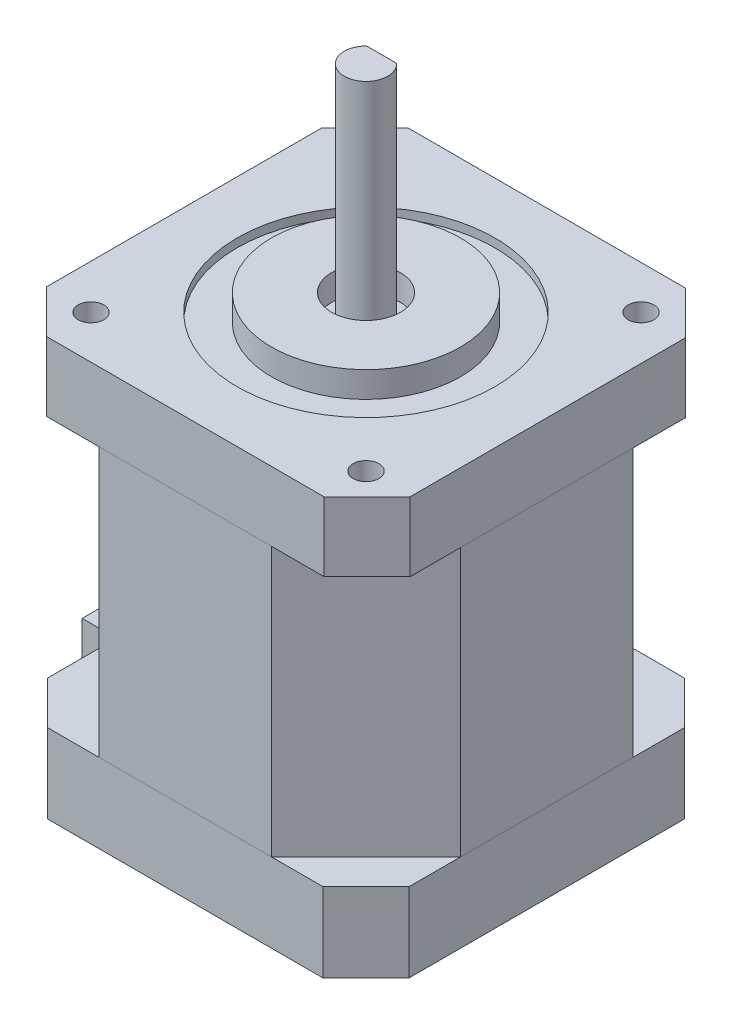
from build123d import *

# Parameters (mm, degrees)
SKETCH2_W             = 42.05
SKETCH2_H             = 42.05
BOSS_EXTRUDE1_DEPTH   = 9.2
CHAMFER1_SIZE         = 5
BOSS_EXTRUDE2_DEPTH   = 31.3
SKETCH4_W             = 42.305589702
SKETCH4_H             = 42.05
BOSS_EXTRUDE3_DEPTH   = 8.05
CHAMFER2_SIZE         = 5
SKETCH5_R             = 15
CUT_EXTRUDE1_DEPTH    = 1
SKETCH6_R             = 11
BOSS_EXTRUDE5_DEPTH   = 3
SKETCH7_R             = 4
CUT_EXTRUDE2_DEPTH    = 3
SKETCH8_R             = 2.525
BOSS_EXTRUDE6_DEPTH   = 26.05
SKETCH9_R             = 3
CUT_EXTRUDE3_DEPTH    = 24.05
SKETCH10_W            = 2
SKETCH10_H            = 16
BOSS_EXTRUDE7_DEPTH   = 4
SKETCH11_W            = 6
SKETCH11_H            = 16
BOSS_EXTRUDE8_DEPTH   = 4
CUT_EXTRUDE4_DEPTH    = 4
BODY_MOVE_COPY1_ANGLE = 90
SKETCH13_R            = 4.65
CUT_EXTRUDE5_DEPTH    = 4.1
CUT_EXTRUDE6_DEPTH    = 2
SKETCH15_R            = 1.5
CUT_EXTRUDE7_DEPTH    = 5


with BuildPart() as part:
    # Sketch2 → Boss-Extrude1 (new body)
    with BuildSketch(Plane.XY):
        Rectangle(SKETCH2_W, SKETCH2_H)
    extrude(amount=BOSS_EXTRUDE1_DEPTH)

    # Chamfer1
    chamfer1_edges = [part.edges().sort_by_distance(p)[0] for p in [
        (21.025, -21.025, 4.6),
        (-21.025, -21.025, 4.6),
        (-21.025, 21.025, 4.6),
        (21.025, 21.025, 4.6),
    ]]
    chamfer(chamfer1_edges, length=CHAMFER1_SIZE)

    # Sketch10 → Boss-Extrude7 (add)
    with BuildSketch(Plane.ZY.offset(21.025)):
        with Locations((1, 0)):
            Rectangle(SKETCH10_W, SKETCH10_H)
    extrude(amount=BOSS_EXTRUDE7_DEPTH)


with BuildPart() as body_2:
    # Sketch3 → Boss-Extrude2 (new body)
    with BuildSketch(Plane.XY.offset(9.2)):
        Polygon((-21.025, 11.025), (-11.025, 21.025), (10.025, 21.025), (21.025, 10.025), (21.025, -10.025), (10.025, -21.025), (-10.025, -21.025), (-21.025, -10.025), align=None)
    extrude(amount=BOSS_EXTRUDE2_DEPTH)


with BuildPart() as body_3:
    # Sketch4 → Boss-Extrude3 (new body)
    with BuildSketch(Plane.XY.offset(40.5)):
        Rectangle(SKETCH4_W, SKETCH4_H)
    extrude(amount=BOSS_EXTRUDE3_DEPTH)

    # Chamfer2
    chamfer2_edges = [body_3.edges().sort_by_distance(p)[0] for p in [
        (21.152794851, -21.025, 44.525),
        (-21.152794851, -21.025, 44.525),
        (-21.152794851, 21.025, 44.525),
        (21.152794851, 21.025, 44.525),
    ]]
    chamfer(chamfer2_edges, length=CHAMFER2_SIZE)

    # Sketch5 → Cut-Extrude1 (cut)
    with BuildSketch(Plane.XY.offset(48.55)):
        Circle(SKETCH5_R)
    extrude(amount=-CUT_EXTRUDE1_DEPTH, mode=Mode.SUBTRACT)

    # Sketch6 → Boss-Extrude5 (add)
    with BuildSketch(Plane.XY.offset(47.55)):
        Circle(SKETCH6_R)
    extrude(amount=BOSS_EXTRUDE5_DEPTH)

    # Sketch7 → Cut-Extrude2 (cut)
    with BuildSketch(Plane.XY.offset(50.55)):
        Circle(SKETCH7_R)
    extrude(amount=-CUT_EXTRUDE2_DEPTH, mode=Mode.SUBTRACT)

    # Sketch8 → Boss-Extrude6 (add)
    with BuildSketch(Plane.XY.offset(47.55)):
        Circle(SKETCH8_R)
    extrude(amount=BOSS_EXTRUDE6_DEPTH)

    # Sketch9 → Cut-Extrude3 (cut)
    with BuildSketch(Plane.XY.offset(73.6)):
        Circle(SKETCH9_R)
        with BuildLine():
            Line((-1.744992837, 1.825), (1.744992837, 1.825))
            ThreePointArc((1.744992837, 1.825), (0, -2.525), (-1.744992837, 1.825))
        make_face(mode=Mode.SUBTRACT)
    extrude(amount=-CUT_EXTRUDE3_DEPTH, mode=Mode.SUBTRACT)


with BuildPart() as body_4:
    # Sketch11 → Boss-Extrude8 (new body)
    with BuildSketch(Plane.ZY.offset(21.025)):
        with Locations((6.2, 0)):
            Rectangle(SKETCH11_W, SKETCH11_H)
    extrude(amount=BOSS_EXTRUDE8_DEPTH)

    # Sketch12 → Cut-Extrude4 (cut)
    with BuildSketch(Plane.ZY.offset(25.025)):
        Polygon((8.2, 4), (10.029701623, 4), (10.029701623, -4), (8.2, -4), (8.2, -6.5), (4.2, -6.5), (4.2, 6.5), (8.2, 6.5), align=None)
    extrude(amount=-CUT_EXTRUDE4_DEPTH, mode=Mode.SUBTRACT)


with BuildPart() as part_1:
    # Body-Move/Copy1: moved
    add(part.part.rotate(Axis((0, 0, 36.8), (-1, 0, 0)), BODY_MOVE_COPY1_ANGLE))

    # Sketch13 → Cut-Extrude5 (cut)
    with BuildSketch(Plane.XZ.offset(36.8)):
        with Locations(Location((0, 36.8, 0), (0, 0, 270))):
            Circle(SKETCH13_R)
    extrude(amount=-CUT_EXTRUDE5_DEPTH, mode=Mode.SUBTRACT)

    # Sketch14 → Cut-Extrude6 (cut)
    with BuildSketch(Plane(origin=(0, -36.8, 0), x_dir=(-1, 0, 0), z_dir=(0, -1, 0))):
        with BuildLine():
            ThreePointArc((18.5, -52.3), (17.621320344, -50.178679656), (15.5, -49.3))
            Line((15.5, -49.3), (15.5, -52.3))
            Line((15.5, -52.3), (12.5, -52.3))
            ThreePointArc((12.5, -52.3), (15.5, -55.3), (18.5, -52.3))
        make_face()
        with BuildLine():
            Line((15.5, -52.3), (15.5, -49.3))
            ThreePointArc((15.5, -49.3), (13.378679656, -50.178679656), (12.5, -52.3))
            Line((12.5, -52.3), (15.5, -52.3))
        make_face()
        with BuildLine():
            ThreePointArc((-12.5, -52.3), (-13.378679656, -50.178679656), (-15.5, -49.3))
            Line((-15.5, -49.3), (-15.5, -52.3))
            Line((-15.5, -52.3), (-12.5, -52.3))
        make_face()
        with BuildLine():
            Line((-15.5, -52.3), (-15.5, -49.3))
            ThreePointArc((-15.5, -49.3), (-17.621320344, -54.421320344), (-12.5, -52.3))
            Line((-12.5, -52.3), (-15.5, -52.3))
        make_face()
        with BuildLine():
            ThreePointArc((-15.5, -24.3), (-13.378679656, -23.421320344), (-12.5, -21.3))
            Line((-12.5, -21.3), (-15.5, -21.3))
            Line((-15.5, -21.3), (-15.5, -24.3))
        make_face()
        with BuildLine():
            Line((-15.5, -21.3), (-12.5, -21.3))
            ThreePointArc((-12.5, -21.3), (-17.621320344, -19.178679656), (-15.5, -24.3))
            Line((-15.5, -24.3), (-15.5, -21.3))
        make_face()
        with BuildLine():
            ThreePointArc((18.5, -21.3), (15.5, -18.3), (12.5, -21.3))
            Line((12.5, -21.3), (15.5, -21.3))
            Line((15.5, -21.3), (15.5, -24.3))
            ThreePointArc((15.5, -24.3), (17.621320344, -23.421320344), (18.5, -21.3))
        make_face()
        with BuildLine():
            Line((15.5, -21.3), (12.5, -21.3))
            ThreePointArc((12.5, -21.3), (13.378679656, -23.421320344), (15.5, -24.3))
            Line((15.5, -24.3), (15.5, -21.3))
        make_face()
    extrude(amount=-CUT_EXTRUDE6_DEPTH, mode=Mode.SUBTRACT)


with BuildPart() as body_3_1:
    # Body-Move/Copy1: moved
    add(body_3.part.rotate(Axis((0, 0, 36.8), (-1, 0, 0)), BODY_MOVE_COPY1_ANGLE))

    # Sketch15 → Cut-Extrude7 (cut)
    with BuildSketch(Plane(origin=(0, 11.75, 0), x_dir=(1, 0, 0), z_dir=(0, 1, 0))):
        with Locations(Location((-16, -20.8, 0), (0, 0, 270))):
            Circle(SKETCH15_R)
        with Locations(Location((16, -20.8, 0), (0, 0, 270))):
            Circle(SKETCH15_R)
        with Locations(Location((16, -52.8, 0), (0, 0, 270))):
            Circle(SKETCH15_R)
        with Locations(Location((-16, -52.8, 0), (0, 0, 270))):
            Circle(SKETCH15_R)
    extrude(amount=-CUT_EXTRUDE7_DEPTH, mode=Mode.SUBTRACT)


with BuildPart() as body_4_1:
    # Body-Move/Copy1: moved
    add(body_4.part.rotate(Axis((0, 0, 36.8), (-1, 0, 0)), BODY_MOVE_COPY1_ANGLE))


with BuildPart() as body_2_1:
    # Body-Move/Copy1: moved
    add(body_2.part.rotate(Axis((0, 0, 36.8), (-1, 0, 0)), BODY_MOVE_COPY1_ANGLE))


solid = Compound([part_1.part, body_3_1.part, body_4_1.part, body_2_1.part])
